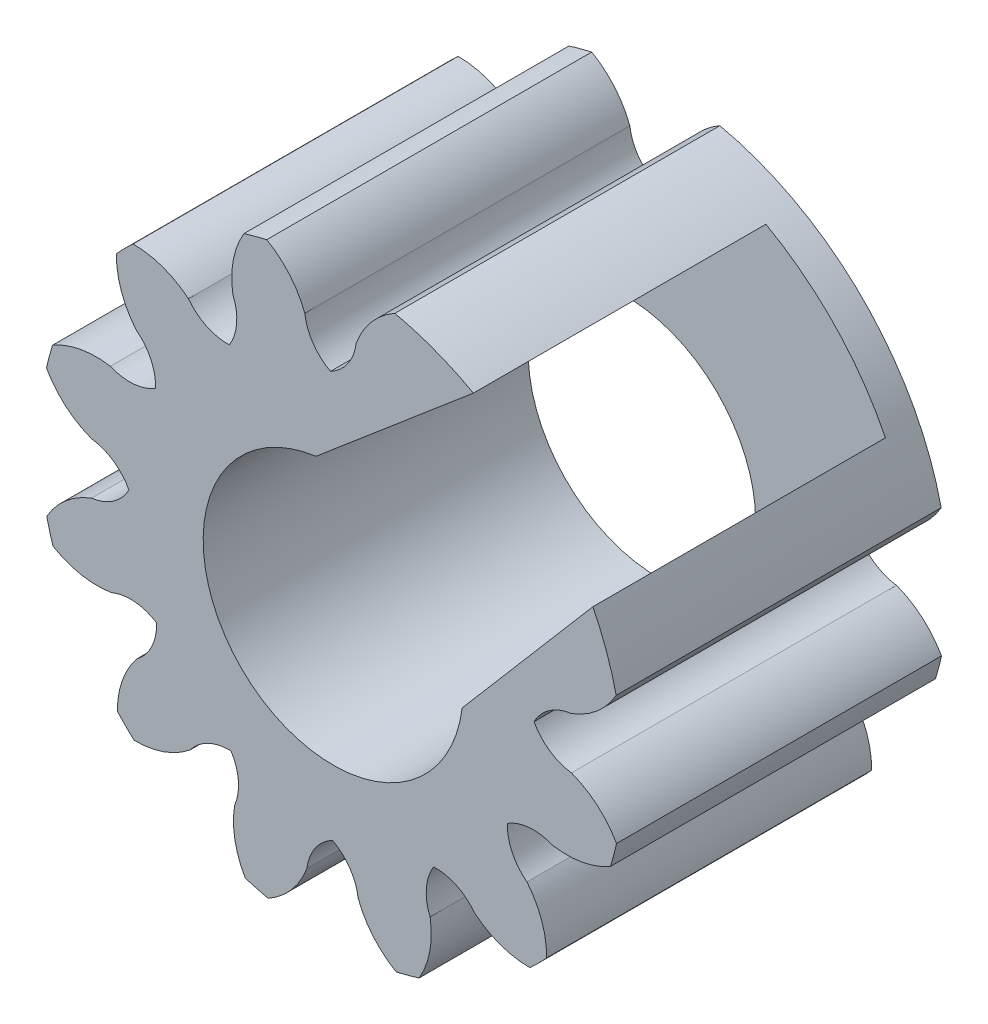
from build123d import *

# Parameters (mm, degrees)
SKETCH1_R           = 8.98338725
BOSS_EXTRUDE2_DEPTH = 10
CUT_EXTRUDE1_DEPTH  = 9
SKETCH9_R           = 4
CUT_EXTRUDE4_DEPTH  = 10
CUT_EXTRUDE5_DEPTH  = 10
CIRPATTERN2_COUNT   = 10
CIRPATTERN2_ANGLE   = 270


with BuildPart() as part:
    # Sketch1 → Boss-Extrude2 (new body)
    with BuildSketch(Plane.XY):
        Circle(SKETCH1_R)
    extrude(amount=-BOSS_EXTRUDE2_DEPTH)

    # Sketch2 → Cut-Extrude1 (cut)
    with BuildSketch(Plane.XY):
        with BuildLine():
            Line((-1.97475772, 2.477093755), (4.365982639, 7.851079039))
            ThreePointArc((4.365982639, 7.851079039), (6.497023817, 6.204025146), (8.044056542, 3.999300044))
            Line((8.044056542, 3.999300044), (2.911023025, -2.008935037))
            ThreePointArc((2.911023025, -2.008935037), (-2.230434429, -2.704958194), (-1.97475772, 2.477093755))
        make_face()
    extrude(amount=-CUT_EXTRUDE1_DEPTH, mode=Mode.SUBTRACT)

    # Sketch9 → Cut-Extrude4 (cut)
    with BuildSketch(Plane.XY):
        with Locations((0.051031531, -0.220189823)):
            Circle(SKETCH9_R)
    extrude(amount=-CUT_EXTRUDE4_DEPTH, mode=Mode.SUBTRACT)

    # Sketch10 → Cut-Extrude5 (cut)
    with BuildSketch(Plane.XY):
        with BuildLine():
            ThreePointArc((-0.030614018, 6.232538227), (0.505170096, 6.710825662), (0.759385982, 7.382538227))
            ThreePointArc((0.759385982, 7.382538227), (1.276411254, 8.232191257), (2.069385982, 8.832538227))
            ThreePointArc((2.069385982, 8.832538227), (-0.030614018, 8.990934274), (-2.130614018, 8.832538227))
            ThreePointArc((-2.130614018, 8.832538227), (-1.33763929, 8.232191257), (-0.820614018, 7.382538227))
            ThreePointArc((-0.820614018, 7.382538227), (-0.566398131, 6.710825662), (-0.030614018, 6.232538227))
        make_face()
    cut_extrude5 = extrude(amount=-CUT_EXTRUDE5_DEPTH, mode=Mode.SUBTRACT)

    # CirPattern2: Cut-Extrude5 ×10 about axis
    cirpattern2_axis = Axis((0, 0, 0), (0, 0, 1))
    for i in range(1, CIRPATTERN2_COUNT):
        add(cut_extrude5.rotate(cirpattern2_axis, i * CIRPATTERN2_ANGLE / (CIRPATTERN2_COUNT - 1)), mode=Mode.SUBTRACT)


solid = part.part
